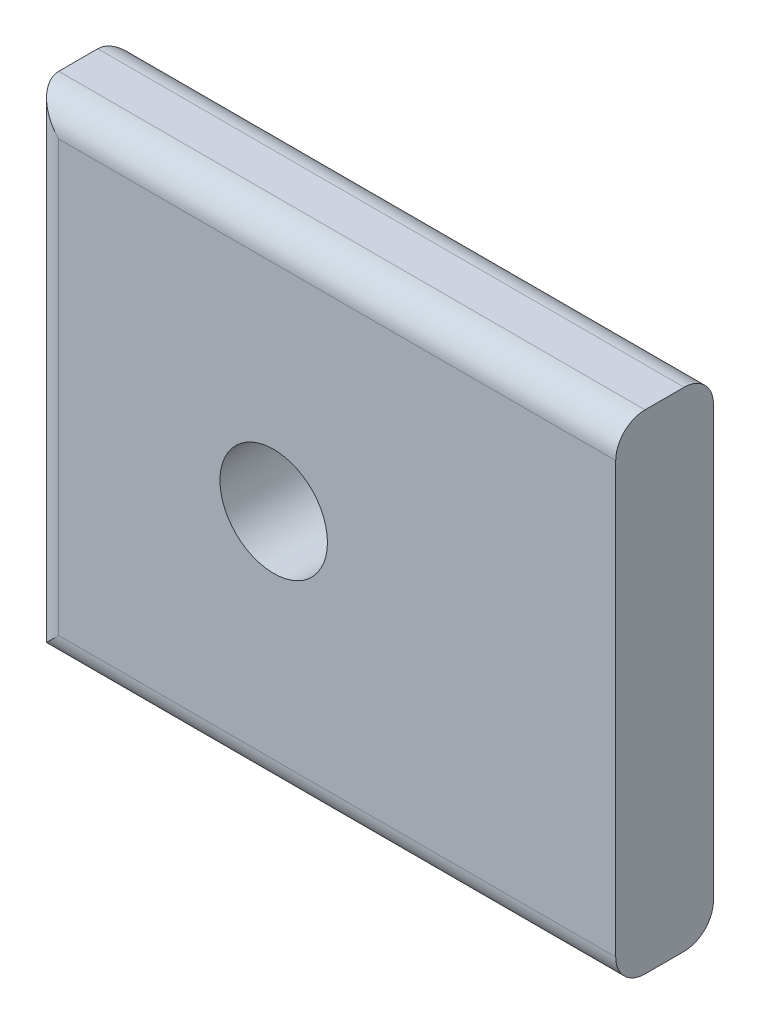
from build123d import *

# Parameters (mm, degrees)
SKETCH_1_W          = 60
SKETCH_1_H          = 50
EXTRUDE_1_DEPTH     = 10
SKETCH_2_R          = 5.5
CUT_EXTRUDE_1_DEPTH = 10
FILLET_1_R          = 3


with BuildPart() as part:
    # 草图1 → 凸台-拉伸1 (new body)
    with BuildSketch(Plane.XY):
        Rectangle(SKETCH_1_W, SKETCH_1_H)
    extrude(amount=EXTRUDE_1_DEPTH)

    # 草图2 → 切除-拉伸1 (cut)
    with BuildSketch(Plane.XY.offset(10)):
        with Locations((-5, 0)):
            Circle(SKETCH_2_R)
    extrude(amount=-CUT_EXTRUDE_1_DEPTH, mode=Mode.SUBTRACT)

    # 圆角1
    fillet_1_edges = [part.edges().sort_by_distance(p)[0] for p in [
        (-30, 0, 10),
        (0, -25, 10),
        (0, -25, 0),
        (-30, 0, 0),
        (0, 25, 0),
        (0, 25, 10),
    ]]
    fillet(fillet_1_edges, radius=FILLET_1_R)


solid = part.part
